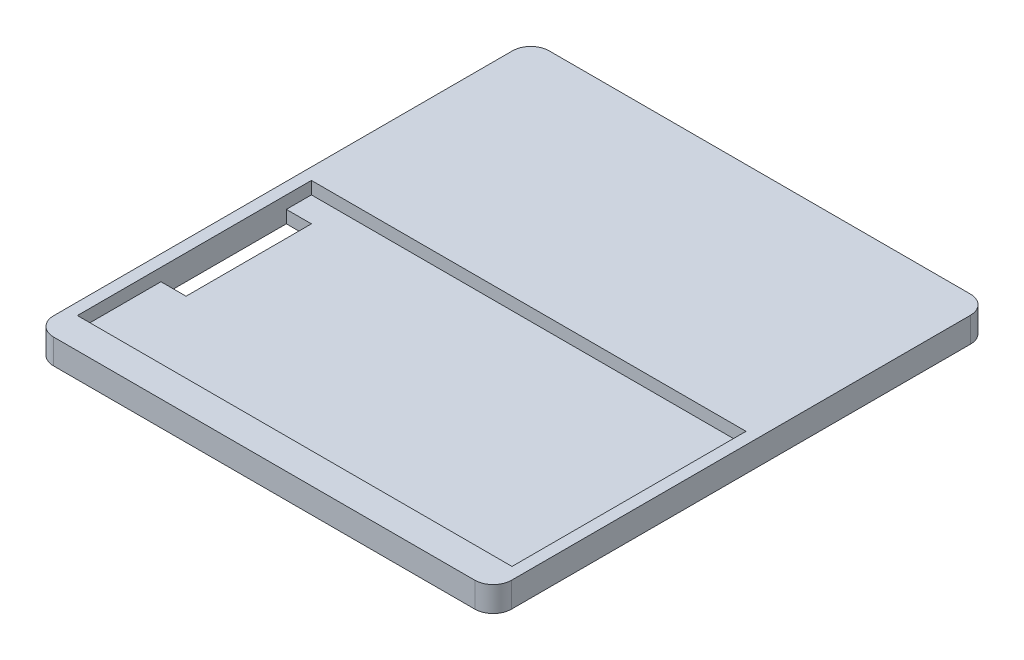
from build123d import *

# Parameters (mm, degrees)
SKETCH1_W           = 54.8
SKETCH1_H           = 59.3
BOSS_EXTRUDE1_DEPTH = 3
FILLET1_R           = 2.2
SKETCH2_W           = 3
SKETCH2_H           = 15
CUT_EXTRUDE1_DEPTH  = 41.483113764
CUT_EXTRUDE2_DEPTH  = 1.5


with BuildPart() as part:
    # Sketch1 → Boss-Extrude1 (new body)
    with BuildSketch(Plane(origin=(0, 0, 0), x_dir=(1, 0, 0), z_dir=(0, 1, 0))):
        Rectangle(SKETCH1_W, SKETCH1_H)
    extrude(amount=BOSS_EXTRUDE1_DEPTH)

    # Fillet1
    fillet1_edges = [part.edges().sort_by_distance(p)[0] for p in [
        (27.4, 1.5, 29.65),
        (-27.4, 1.5, 29.65),
        (-27.4, 1.5, -29.65),
        (27.4, 1.5, -29.65),
    ]]
    fillet(fillet1_edges, radius=FILLET1_R)

    # Sketch2 → Cut-Extrude1 (cut, through all)
    with BuildSketch(Plane(origin=(0, 3, 0), x_dir=(1, 0, 0), z_dir=(0, 1, 0))):
        with Locations((-24.5, -8.5)):
            Rectangle(SKETCH2_W, SKETCH2_H)
    extrude(amount=-CUT_EXTRUDE1_DEPTH, mode=Mode.SUBTRACT)

    # Sketch2<3> → Cut-Extrude2 (cut)
    with BuildSketch(Plane(origin=(0, 3, 0), x_dir=(1, 0, 0), z_dir=(0, 1, 0))):
        Polygon((-26, -16), (-26, -26), (26, -26), (26, 2), (-26, 2), (-26, -1), (-23, -1), (-23, -16), align=None)
    extrude(amount=-CUT_EXTRUDE2_DEPTH, mode=Mode.SUBTRACT)


solid = part.part
